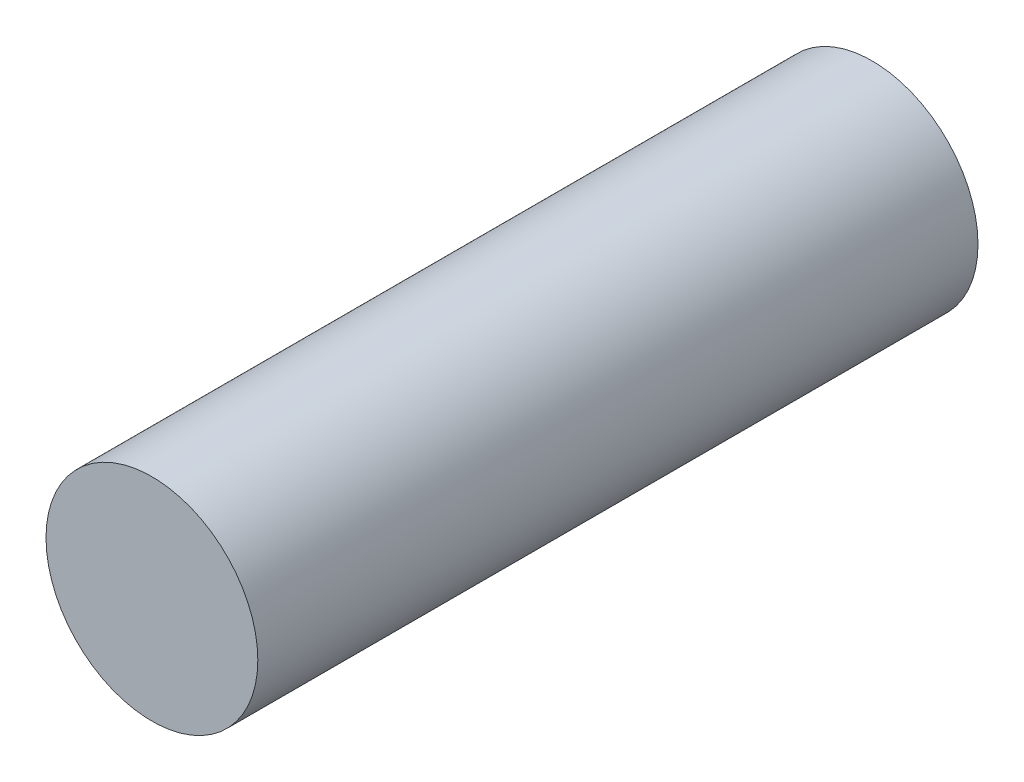
from build123d import *

# Parameters (mm, degrees)
SKETCH1_R           = 5
BOSS_EXTRUDE1_DEPTH = 34


with BuildPart() as part:
    # Sketch1 → Boss-Extrude1 (new body)
    with BuildSketch(Plane.XY):
        Circle(SKETCH1_R)
    extrude(amount=BOSS_EXTRUDE1_DEPTH)


solid = part.part
